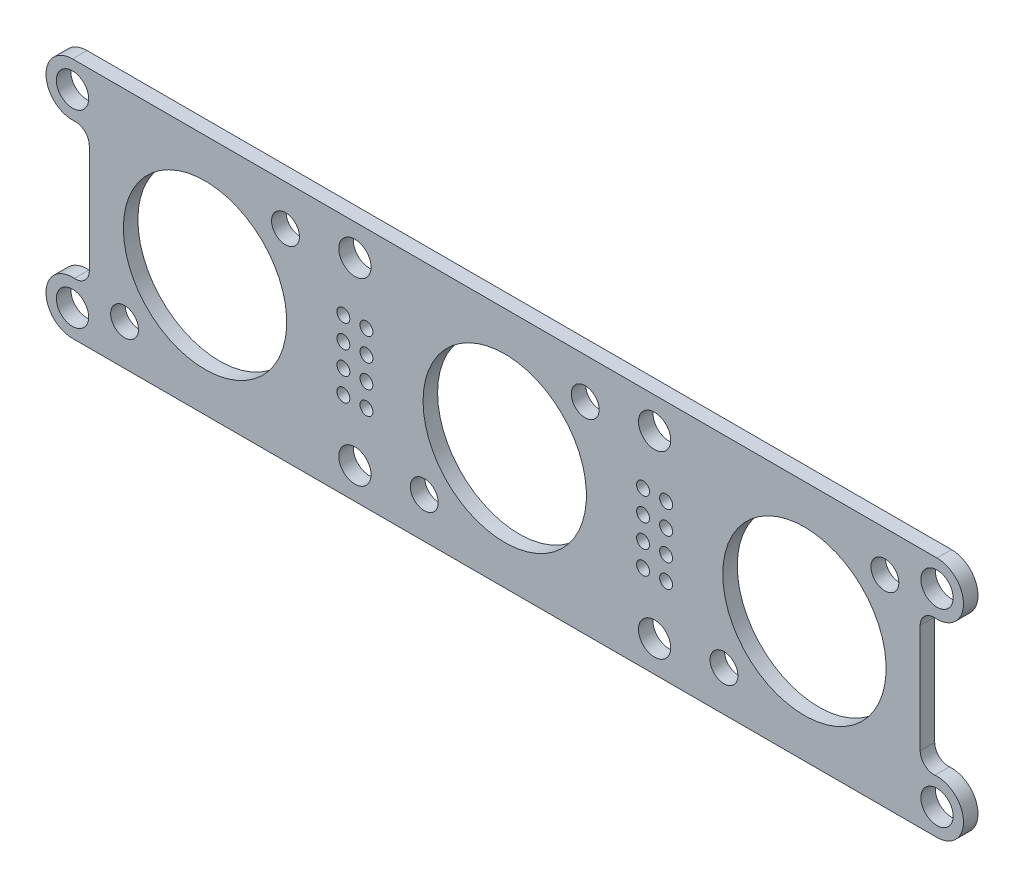
from build123d import *

# Parameters (mm, degrees)
SKETCH1_R               = 4.5
BOSS_EXTRUDE1_DEPTH     = 0.8
SKETCH2_R               = 0.767914883
SKETCH2_R_2             = 0.3556
SKETCH2_R_3             = 4.5
CUT_EXTRUDE1_DEPTH      = 27.149953829
CUT_EXTRUDE2_DEPTH      = 27.149953829
CUT_EXTRUDE2_DEPTH_BACK = 27.149953829
SKETCH3_R               = 0.889


with BuildPart() as part:
    # Sketch1 → Boss-Extrude1 (new body)
    with BuildSketch(Plane(origin=(0, 0, -38.7925), x_dir=(-1, 0, 0), z_dir=(0, 0, -1))):
        with BuildLine():
            Line((23.8125, 6.6675), (-23.8125, 6.6675))
            ThreePointArc((-23.8125, 6.6675), (-25.272010309, 5.153242143), (-23.705057143, 3.750457422))
            ThreePointArc((-23.705057143, 3.750457422), (-23.130382387, 3.548805041), (-22.887, 2.990522163))
            Line((-22.887, 2.990522163), (-22.887, -2.990522163))
            ThreePointArc((-22.887, -2.990522163), (-23.130382387, -3.548805041), (-23.705057143, -3.750457422))
            ThreePointArc((-23.705057143, -3.750457422), (-25.272010309, -5.153242143), (-23.8125, -6.6675))
            Line((-23.8125, -6.6675), (23.8125, -6.6675))
            ThreePointArc((23.8125, -6.6675), (25.272010309, -5.153242143), (23.705057143, -3.750457422))
            ThreePointArc((23.705057143, -3.750457422), (23.130382387, -3.548805041), (22.887, -2.990522163))
            Line((22.887, -2.990522163), (22.887, 2.990522163))
            ThreePointArc((22.887, 2.990522163), (23.130382387, 3.548805041), (23.705057143, 3.750457422))
            ThreePointArc((23.705057143, 3.750457422), (25.272010309, 5.153242143), (23.8125, 6.6675))
        make_face()
        with Locations((16.51, 0)):
            Circle(SKETCH1_R, mode=Mode.SUBTRACT)
        Circle(SKETCH1_R, mode=Mode.SUBTRACT)
        with Locations((-16.51, 0)):
            Circle(SKETCH1_R, mode=Mode.SUBTRACT)
    extrude(amount=BOSS_EXTRUDE1_DEPTH)

    # Sketch2 → Cut-Extrude1 (cut, through all)
    with BuildSketch(Plane(origin=(0, 0, -39.5925), x_dir=(-1, 0, 0), z_dir=(0, 0, -1))):
        with Locations((-12.077914883, -4.432085117)):
            Circle(SKETCH2_R)
        with Locations((-20.942085117, 4.432085117)):
            Circle(SKETCH2_R)
        with Locations((-4.432085117, 4.432085117)):
            Circle(SKETCH2_R)
        with Locations((-7.62, -1.905)):
            Circle(SKETCH2_R_2)
        with Locations((20.942085117, -4.432085117)):
            Circle(SKETCH2_R)
        with Locations((12.077914883, 4.432085117)):
            Circle(SKETCH2_R)
        with Locations((4.432085117, -4.432085117)):
            Circle(SKETCH2_R)
        with Locations((-8.89, -1.905)):
            Circle(SKETCH2_R_2)
        with Locations((-7.62, 1.905)):
            Circle(SKETCH2_R_2)
        with Locations((-8.89, 1.905)):
            Circle(SKETCH2_R_2)
        with Locations((-7.62, 0.635)):
            Circle(SKETCH2_R_2)
        with Locations((-8.89, 0.635)):
            Circle(SKETCH2_R_2)
        Circle(SKETCH2_R_3)
        with Locations((-7.62, -0.635)):
            Circle(SKETCH2_R_2)
        with Locations((-8.89, -0.635)):
            Circle(SKETCH2_R_2)
        with Locations((8.89, 1.905)):
            Circle(SKETCH2_R_2)
        with Locations((7.62, 1.905)):
            Circle(SKETCH2_R_2)
        with Locations((8.89, -1.905)):
            Circle(SKETCH2_R_2)
        with Locations((7.62, -1.905)):
            Circle(SKETCH2_R_2)
        with Locations((8.89, -0.635)):
            Circle(SKETCH2_R_2)
        with Locations((7.62, -0.635)):
            Circle(SKETCH2_R_2)
        with Locations((8.89, 0.635)):
            Circle(SKETCH2_R_2)
        with Locations((7.62, 0.635)):
            Circle(SKETCH2_R_2)
    extrude(amount=-CUT_EXTRUDE1_DEPTH, mode=Mode.SUBTRACT)

    # Sketch3 → Cut-Extrude2 (cut, two sides: drawn at the far end of the back side and taken through both)
    with BuildSketch(Plane(origin=(0, 0, -39.5925), x_dir=(-1, 0, 0), z_dir=(0, 0, -1)).offset(-CUT_EXTRUDE2_DEPTH_BACK)):
        with Locations((-23.8125, 5.207)):
            Circle(SKETCH3_R)
        with Locations((-23.8125, -5.207)):
            Circle(SKETCH3_R)
        with Locations((23.8125, 5.207)):
            Circle(SKETCH3_R)
        with Locations((23.8125, -5.207)):
            Circle(SKETCH3_R)
        with Locations((-8.255, 4.953)):
            Circle(SKETCH3_R)
        with Locations((8.255, 4.953)):
            Circle(SKETCH3_R)
        with Locations((8.255, -4.953)):
            Circle(SKETCH3_R)
        with Locations((-8.255, -4.953)):
            Circle(SKETCH3_R)
    extrude(amount=CUT_EXTRUDE2_DEPTH + CUT_EXTRUDE2_DEPTH_BACK, mode=Mode.SUBTRACT)


solid = part.part
